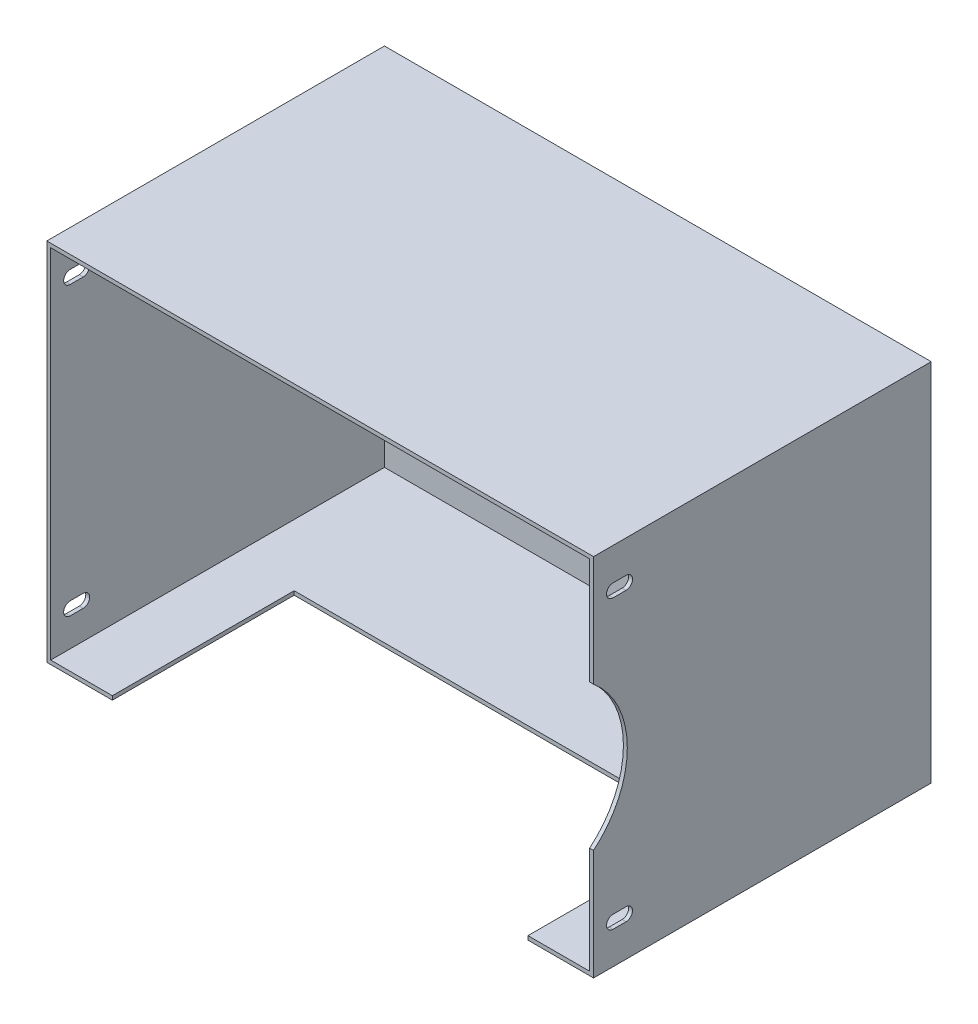
from build123d import *

# Parameters (mm, degrees)
SKETCH_1_W               = 210.5
SKETCH_1_H               = 140.5
EXTRUDE_1_DEPTH          = 130
SHELL_1_T                = -1.5
CUT_EXTRUDE_2_REACH      = 259.187
CUT_EXTRUDE_3_REACH      = 220.444
SKETCH_3_W               = 160
SKETCH_3_H               = 70
CUT_EXTRUDE_4_DEPTH      = 258.187310146
CUT_EXTRUDE_4_DEPTH_BACK = 258.187310146


with BuildPart() as part:
    # 草图1 → 凸台-拉伸1 (new body)
    with BuildSketch(Plane.XY):
        Rectangle(SKETCH_1_W, SKETCH_1_H)
    extrude(amount=EXTRUDE_1_DEPTH)

    # 抽壳1
    shell_1_openings = [part.faces().sort_by_distance(p)[0] for p in [
        (0, 0, 130),
    ]]
    offset(amount=SHELL_1_T, openings=shell_1_openings, kind=Kind.INTERSECTION)

    # 草图2 → 切除-拉伸2 (cut, up to next)
    with BuildSketch(Plane(origin=(105.25, 0, 0), x_dir=(0, 0, -1), z_dir=(1, 0, 0)), mode=Mode.PRIVATE) as cut_extrude_2_sk1:
        with BuildLine():
            Line((-130, 27.694764848), (-130, -27.694764848))
            ThreePointArc((-130, -27.694764848), (-117, 0), (-130, 27.694764848))
        make_face()
    cut_extrude_2_tool1 = extrude(cut_extrude_2_sk1.sketch, amount=-CUT_EXTRUDE_2_REACH, mode=Mode.PRIVATE) & part.part
    add(cut_extrude_2_tool1.solids().sort_by_distance((105.25, 0, 124.710058))[0], mode=Mode.SUBTRACT)

    # 草图3 → 切除-拉伸3 (cut, up to next)
    with BuildSketch(Plane.XZ.offset(70.25), mode=Mode.PRIVATE) as cut_extrude_3_sk1:
        with Locations((0, 95)):
            Rectangle(SKETCH_3_W, SKETCH_3_H)
    cut_extrude_3_tool1 = extrude(cut_extrude_3_sk1.sketch, amount=-CUT_EXTRUDE_3_REACH, mode=Mode.PRIVATE) & part.part
    add(cut_extrude_3_tool1.solids().sort_by_distance((0, -70.25, 95))[0], mode=Mode.SUBTRACT)

    # 草图4 → 切除-拉伸4 (cut, two sides: drawn at the far end of the back side and taken through both)
    with BuildSketch(Plane(origin=(105.25, 0, 0), x_dir=(0, 0, -1), z_dir=(1, 0, 0)).offset(-CUT_EXTRUDE_4_DEPTH_BACK)):
        with BuildLine():
            Line((-122.5, 57.75), (-117.5, 57.75))
            ThreePointArc((-117.5, 57.75), (-115, 55.25), (-117.5, 52.75))
            Line((-117.5, 52.75), (-122.5, 52.75))
            ThreePointArc((-122.5, 52.75), (-125, 55.25), (-122.5, 57.75))
        make_face()
        with BuildLine():
            Line((-122.5, -57.75), (-117.5, -57.75))
            ThreePointArc((-117.5, -57.75), (-115, -55.25), (-117.5, -52.75))
            Line((-117.5, -52.75), (-122.5, -52.75))
            ThreePointArc((-122.5, -52.75), (-125, -55.25), (-122.5, -57.75))
        make_face()
    extrude(amount=CUT_EXTRUDE_4_DEPTH + CUT_EXTRUDE_4_DEPTH_BACK, mode=Mode.SUBTRACT)


solid = part.part
